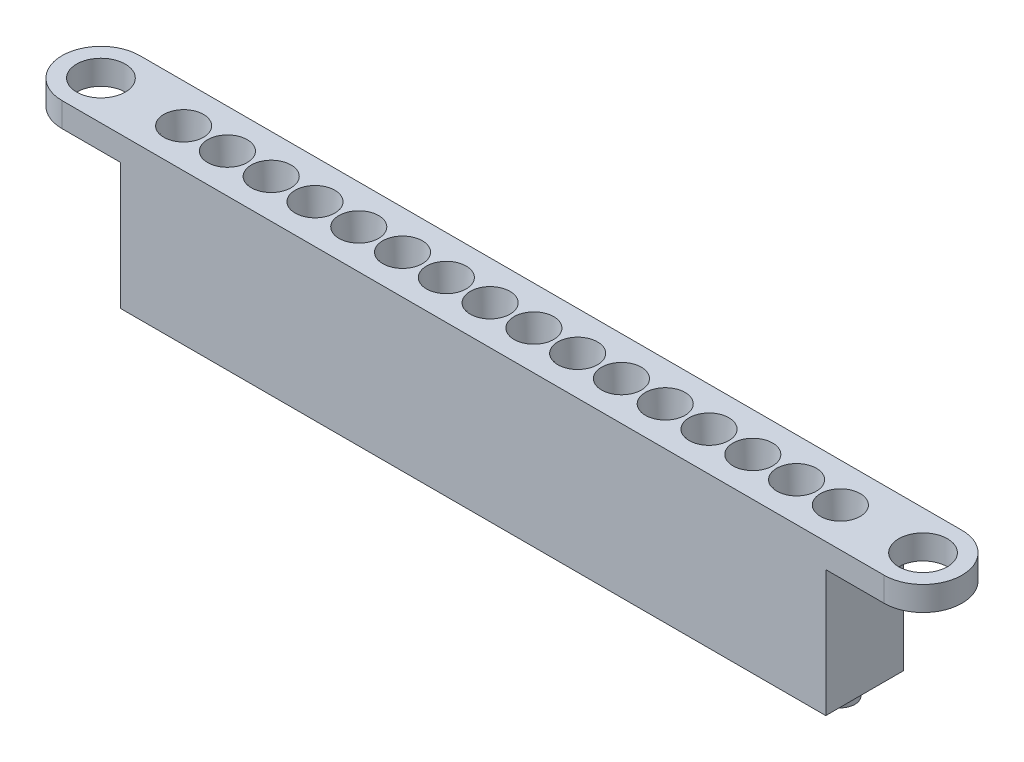
from build123d import *

# Parameters (mm, degrees)
SKETCH43_R               = 2.5
BOSS_EXTRUDE6_DEPTH      = 17
LPATTERN3_COUNT          = 8
LPATTERN3_PITCH          = 4.5
LPATTERN3_COL_COUNT      = 9
LPATTERN3_COL_PITCH      = 4.5
CUT_EXTRUDE13_DEPTH      = 50.437460493
CUT_EXTRUDE13_DEPTH_BACK = 50.437460493
SKETCH44_W               = 10
SKETCH44_H               = 14.5
LPATTERN7_COUNT          = 8
LPATTERN7_PITCH          = 4.5
LPATTERN7_COL_COUNT      = 9
LPATTERN7_COL_PITCH      = 4.5
SKETCH47_W               = 72.5
SKETCH47_H               = 8
SKETCH47_R               = 2
CUT_EXTRUDE14_DEPTH      = 1.5


with BuildPart() as part:
    # Sketch43 → Boss-Extrude6 (new body)
    with BuildSketch(Plane(origin=(0, 0, 0), x_dir=(1, 0, 0), z_dir=(0, 1, 0))):
        with BuildLine():
            Line((42.25, -4), (-42.25, -4))
            ThreePointArc((-42.25, -4), (-46.25, 0), (-42.25, 4))
            Line((-42.25, 4), (42.25, 4))
            ThreePointArc((42.25, 4), (46.25, 0), (42.25, -4))
        make_face()
        with Locations(Location((-42.25, 0, 0), (0, 0, 270))):
            Circle(SKETCH43_R, mode=Mode.SUBTRACT)
        with Locations(Location((42.25, 0, 0), (0, 0, 270))):
            Circle(SKETCH43_R, mode=Mode.SUBTRACT)
    extrude(amount=BOSS_EXTRUDE6_DEPTH)

    # Sketch41 → Cut-Revolve1 (revolve, cut)
    with BuildSketch(Plane.XY, mode=Mode.PRIVATE) as cut_revolve1_sk:
        Polygon((3.25, 0), (4.289764543, 17), (2.25, 17), (2.25, 0), align=None)
    cut_revolve1 = revolve(cut_revolve1_sk.sketch.rotate(Axis((2.25, 17, 0), (0, -1, 0)), 180), axis=Axis((2.25, 17, 0), (0, -1, 0)), mode=Mode.SUBTRACT)

    # LPattern3: Cut-Revolve1 ×8
    with Locations(*[(i * LPATTERN3_PITCH, 0, 0) for i in range(1, LPATTERN3_COUNT)]):
        add(cut_revolve1, mode=Mode.SUBTRACT)

    # LPattern3 col: Cut-Revolve1 ×9
    with Locations(*[(-i * LPATTERN3_COL_PITCH, 0, 0) for i in range(1, LPATTERN3_COL_COUNT)]):
        add(cut_revolve1, mode=Mode.SUBTRACT)

    # Sketch44 → Cut-Extrude13 (cut, two sides: drawn at the far end of the back side and taken through both)
    with BuildSketch(Plane.XY.offset(-CUT_EXTRUDE13_DEPTH_BACK)):
        with Locations((-41.25, 7.25)):
            Rectangle(SKETCH44_W, SKETCH44_H)
        with Locations((41.25, 7.25)):
            Rectangle(SKETCH44_W, SKETCH44_H)
    extrude(amount=CUT_EXTRUDE13_DEPTH + CUT_EXTRUDE13_DEPTH_BACK, mode=Mode.SUBTRACT)

    # Sketch46 → Cut-Revolve2 (revolve, cut)
    with BuildSketch(Plane.XY, mode=Mode.PRIVATE) as cut_revolve2_sk:
        Polygon((3.75, 0), (3.84174393, 1.5), (4.25, 1.5), (4.25, 0), align=None)
    cut_revolve2 = revolve(cut_revolve2_sk.sketch.rotate(Axis((2.25, 17, 0), (0, -1, 0)), 180), axis=Axis((2.25, 17, 0), (0, -1, 0)), mode=Mode.SUBTRACT)

    # LPattern7: Cut-Revolve2 ×8
    with Locations(*[(i * LPATTERN7_PITCH, 0, 0) for i in range(1, LPATTERN7_COUNT)]):
        add(cut_revolve2, mode=Mode.SUBTRACT)

    # LPattern7 col: Cut-Revolve2 ×9
    with Locations(*[(-i * LPATTERN7_COL_PITCH, 0, 0) for i in range(1, LPATTERN7_COL_COUNT)]):
        add(cut_revolve2, mode=Mode.SUBTRACT)

    # Sketch47 → Cut-Extrude14 (cut)
    with BuildSketch(Plane(origin=(0, 0, 0), x_dir=(1, 0, 0), z_dir=(0, 1, 0))):
        Rectangle(SKETCH47_W, SKETCH47_H)
        with Locations((-15.75, 0)):
            Circle(SKETCH47_R, mode=Mode.SUBTRACT)
        with Locations((-20.25, 0)):
            Circle(SKETCH47_R, mode=Mode.SUBTRACT)
        with Locations((-24.75, 0)):
            Circle(SKETCH47_R, mode=Mode.SUBTRACT)
        with Locations((-29.25, 0)):
            Circle(SKETCH47_R, mode=Mode.SUBTRACT)
        with Locations((-33.75, 0)):
            Circle(SKETCH47_R, mode=Mode.SUBTRACT)
        with Locations((11.25, 0)):
            Circle(SKETCH47_R, mode=Mode.SUBTRACT)
        with Locations((6.75, 0)):
            Circle(SKETCH47_R, mode=Mode.SUBTRACT)
        with Locations((2.25, 0)):
            Circle(SKETCH47_R, mode=Mode.SUBTRACT)
        with Locations((-2.25, 0)):
            Circle(SKETCH47_R, mode=Mode.SUBTRACT)
        with Locations((-6.75, 0)):
            Circle(SKETCH47_R, mode=Mode.SUBTRACT)
        with Locations((-11.25, 0)):
            Circle(SKETCH47_R, mode=Mode.SUBTRACT)
        with Locations((33.75, 0)):
            Circle(SKETCH47_R, mode=Mode.SUBTRACT)
        with Locations((29.25, 0)):
            Circle(SKETCH47_R, mode=Mode.SUBTRACT)
        with Locations((24.75, 0)):
            Circle(SKETCH47_R, mode=Mode.SUBTRACT)
        with Locations((20.25, 0)):
            Circle(SKETCH47_R, mode=Mode.SUBTRACT)
        with Locations((15.75, 0)):
            Circle(SKETCH47_R, mode=Mode.SUBTRACT)
    extrude(amount=CUT_EXTRUDE14_DEPTH, mode=Mode.SUBTRACT)


solid = part.part
